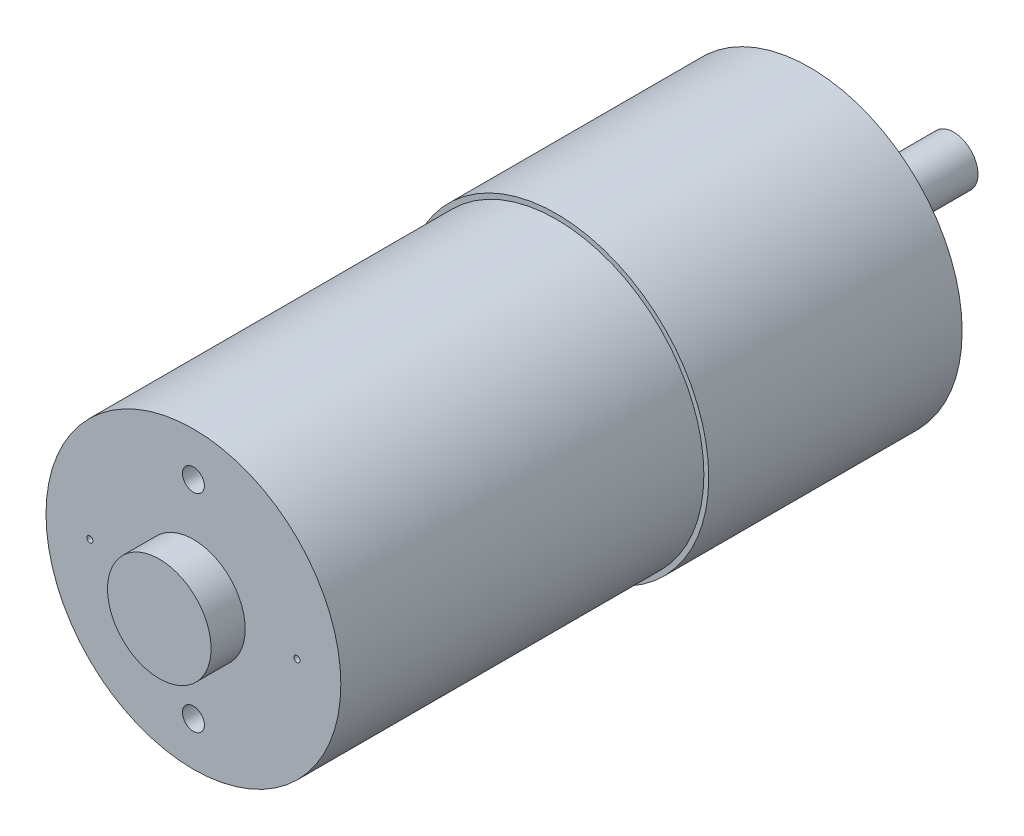
from build123d import *

# Parameters (mm, degrees)
ESBO_O1_R                = 12.5
ESBO_O1_R_2              = 0.9
ESBO_O1_R_3              = 0.25
RESSALTO_EXTRUS_O1_DEPTH = 50.6
ESBO_O2_R                = 3.5
RESSALTO_EXTRUS_O2_DEPTH = 2
ESBO_O3_R                = 2
RESSALTO_EXTRUS_O3_DEPTH = 11.8
ESBO_O4_R                = 4.25
RESSALTO_EXTRUS_O4_DEPTH = 2.8
CORTE_EXTRUS_O1_START    = -29.8
ESBO_O6_R                = 12.5
ESBO_O6_R_2              = 12.1
CORTE_EXTRUS_O1_DEPTH    = 29.8


with BuildPart() as part:
    # Esboço1 → Ressalto-extrusão1 (new body)
    with BuildSketch(Plane.XY):
        Circle(ESBO_O1_R)
        with Locations((0, 8.5)):
            Circle(ESBO_O1_R_2, mode=Mode.SUBTRACT)
        with Locations((0, -8.5)):
            Circle(ESBO_O1_R_2, mode=Mode.SUBTRACT)
        with Locations((8.5, 0)):
            Circle(ESBO_O1_R_3, mode=Mode.SUBTRACT)
        with Locations((-8.5, 0)):
            Circle(ESBO_O1_R_3, mode=Mode.SUBTRACT)
    extrude(amount=RESSALTO_EXTRUS_O1_DEPTH)

    # Esboço2 → Ressalto-extrusão2 (add)
    with BuildSketch(Plane.XY):
        Circle(ESBO_O2_R)
    extrude(amount=-RESSALTO_EXTRUS_O2_DEPTH)

    # Esboço3 → Ressalto-extrusão3 (add)
    with BuildSketch(Plane.XY):
        Circle(ESBO_O3_R)
    extrude(amount=-RESSALTO_EXTRUS_O3_DEPTH)

    # Esboço4 → Ressalto-extrusão4 (add)
    with BuildSketch(Plane.XY.offset(50.6)):
        Circle(ESBO_O4_R)
    extrude(amount=RESSALTO_EXTRUS_O4_DEPTH)

    # Esboço6 → Corte-extrusão1 (cut)
    with BuildSketch(Plane.XY.offset(50.6).offset(CORTE_EXTRUS_O1_START)):
        Circle(ESBO_O6_R)
        Circle(ESBO_O6_R_2, mode=Mode.SUBTRACT)
    extrude(amount=CORTE_EXTRUS_O1_DEPTH, mode=Mode.SUBTRACT)


solid = part.part
